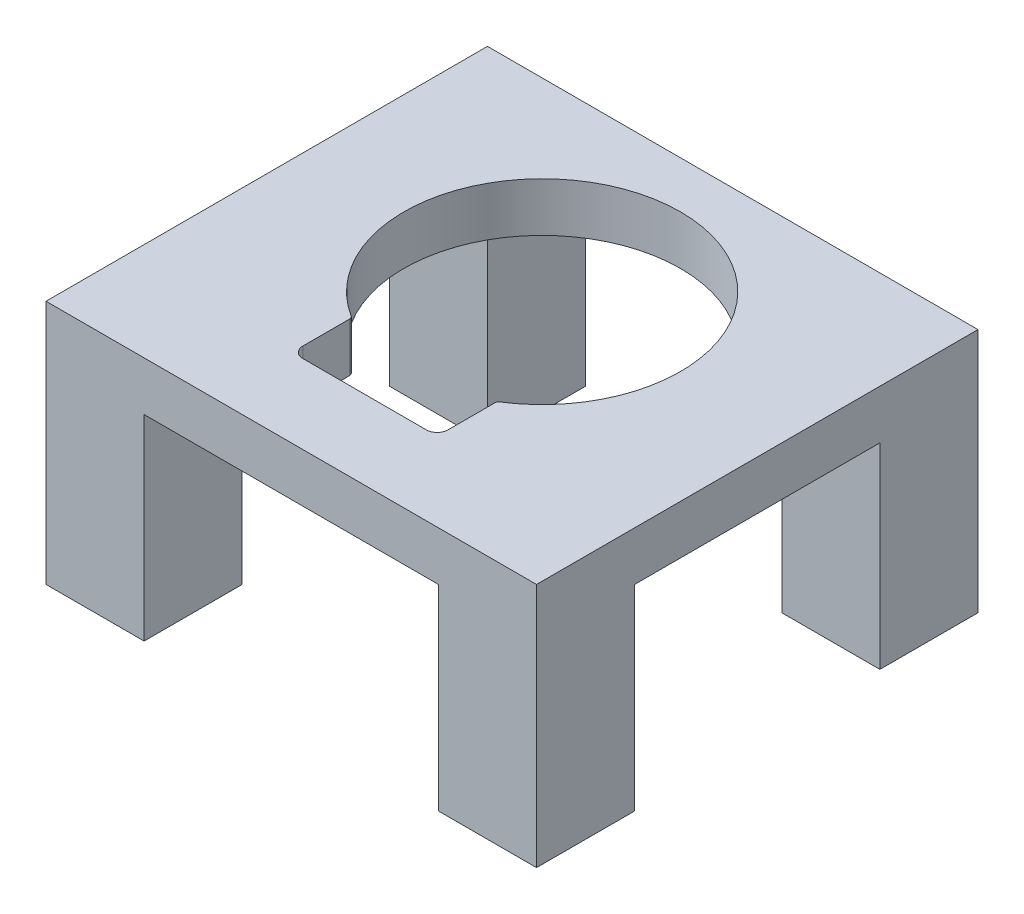
from build123d import *

# Parameters (mm, degrees)
SKETCH1_W           = 50
SKETCH1_H           = 45
BOSS_EXTRUDE1_DEPTH = 5
SKETCH2_W           = 10
SKETCH2_H           = 10
BOSS_EXTRUDE2_DEPTH = 20


with BuildPart() as part:
    # Sketch1 → Boss-Extrude1 (new body)
    with BuildSketch(Plane(origin=(0, 0, 0), x_dir=(1, 0, 0), z_dir=(0, 1, 0))):
        with Locations((0.556666279, -1.630839984)):
            Rectangle(SKETCH1_W, SKETCH1_H)
        with BuildLine():
            Line((-7.4, -15), (-7.4, -10.223338333))
            ThreePointArc((-7.4, -10.223338333), (-7.449237284, -10.031074147), (-7.584827586, -9.886142793))
            ThreePointArc((-7.584827586, -9.886142793), (0, 16.1), (7.584827586, -9.886142793))
            ThreePointArc((7.584827586, -9.886142793), (7.449237284, -10.031074147), (7.4, -10.223338333))
            Line((7.4, -10.223338333), (7.4, -15))
            ThreePointArc((7.4, -15), (7.077817459, -15.777817459), (6.3, -16.1))
            Line((6.3, -16.1), (-6.3, -16.1))
            ThreePointArc((-6.3, -16.1), (-7.077817459, -15.777817459), (-7.4, -15))
        make_face(mode=Mode.SUBTRACT)
    extrude(amount=BOSS_EXTRUDE1_DEPTH)

    # Sketch2 → Boss-Extrude2 (add)
    with BuildSketch(Plane.XZ):
        with Locations((-19.443333721, 19.130839984)):
            Rectangle(SKETCH2_W, SKETCH2_H)
        with Locations((-19.443333721, -15.869160016)):
            Rectangle(SKETCH2_W, SKETCH2_H)
        with Locations((20.556666279, -15.869160016)):
            Rectangle(SKETCH2_W, SKETCH2_H)
        with Locations((20.556666279, 19.130839984)):
            Rectangle(SKETCH2_W, SKETCH2_H)
    extrude(amount=BOSS_EXTRUDE2_DEPTH)


solid = part.part
